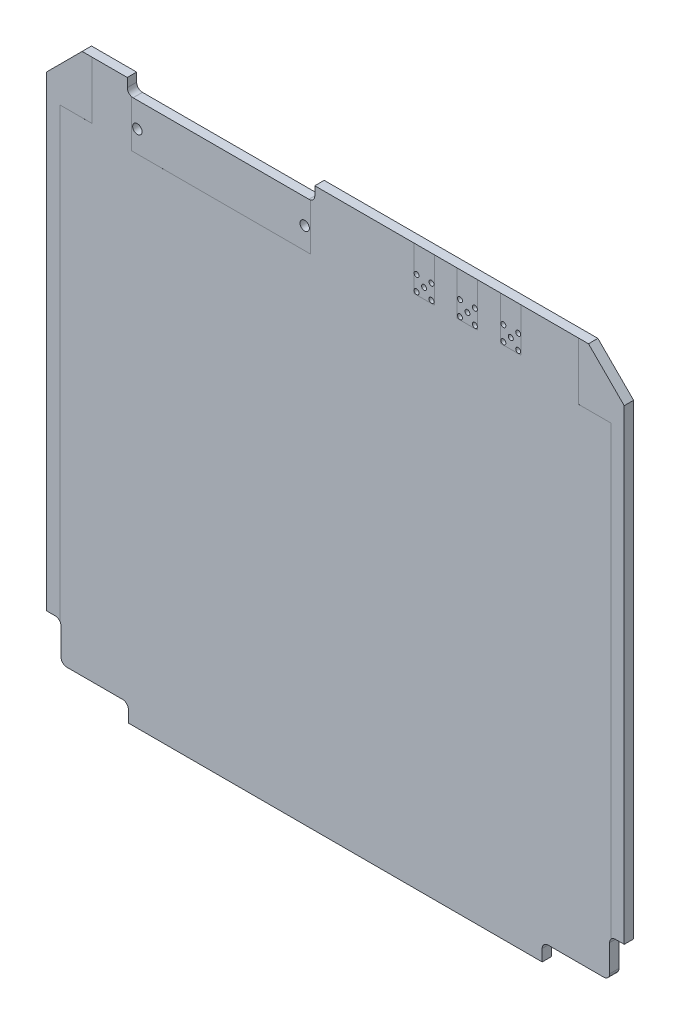
from build123d import *

# Parameters (mm, degrees)
SKETCH1_R           = 0.425
SKETCH1_R_2         = 0.8
BOSS_EXTRUDE1_DEPTH = 1.6
CUT_EXTRUDE1_DEPTH  = 0.0001
CUT_EXTRUDE2_DEPTH  = 0.0001
PARTFOOTPRINTS_W    = 30.48
PARTFOOTPRINTS_H    = 7.989227112
PARTFOOTPRINTS_W_2  = 3.5
PARTFOOTPRINTS_H_2  = 7.45
CUT_EXTRUDE3_DEPTH  = 0.0001


with BuildPart() as part:
    # Sketch1 → Boss-Extrude1 (new body)
    with BuildSketch(Plane(origin=(0, 0, -0.0125), x_dir=(-1, 0, 0), z_dir=(0, 0, -1))):
        with BuildLine():
            Line((35.3, -50), (35.3, -48))
            ThreePointArc((35.3, -48), (35.592893219, -47.292893219), (36.3, -47))
            Line((36.3, -47), (45.8, -47))
            ThreePointArc((45.8, -47), (46.507106781, -46.707106781), (46.8, -46))
            Line((46.8, -46), (46.8, -41.4))
            ThreePointArc((46.8, -41.4), (47.092893219, -40.692893219), (47.8, -40.4))
            Line((47.8, -40.4), (49.3, -40.4))
            Line((49.3, -40.4), (49.3, 39.2))
            Line((49.3, 39.2), (43.2, 45.3))
            Line((43.2, 45.3), (35.500000002, 45.3))
            Line((35.500000002, 45.3), (35.500000002, 43.8))
            ThreePointArc((35.500000002, 43.8), (35.207106783, 43.092893219), (34.500000002, 42.8))
            Line((34.500000002, 42.8), (4.499999998, 42.8))
            ThreePointArc((4.499999998, 42.8), (3.792893217, 43.092893219), (3.499999998, 43.8))
            Line((3.499999998, 43.8), (3.499999998, 45.3))
            Line((3.499999998, 45.3), (-43.2, 45.3))
            Line((-43.2, 45.3), (-49.3, 39.2))
            Line((-49.3, 39.2), (-49.3, -40.4))
            Line((-49.3, -40.4), (-47.8, -40.4))
            ThreePointArc((-47.8, -40.4), (-47.092893219, -40.692893219), (-46.8, -41.4))
            Line((-46.8, -41.4), (-46.8, -46))
            ThreePointArc((-46.8, -46), (-46.507106781, -46.707106781), (-45.8, -47))
            Line((-45.8, -47), (-36.3, -47))
            ThreePointArc((-36.3, -47), (-35.592893219, -47.292893219), (-35.3, -48))
            Line((-35.3, -48), (-35.3, -50))
            Line((-35.3, -50), (35.3, -50))
        make_face()
        with Locations(Location((-21.27, 40.87, 0), (0, 0, 180))):
            Circle(SKETCH1_R, mode=Mode.SUBTRACT)
        with Locations(Location((-23.81, 40.87, 0), (0, 0, 180))):
            Circle(SKETCH1_R, mode=Mode.SUBTRACT)
        with Locations(Location((-22.54, 39.6, 0), (0, 0, 180))):
            Circle(SKETCH1_R, mode=Mode.SUBTRACT)
        with Locations(Location((-13.87, 40.87, 0), (0, 0, 180))):
            Circle(SKETCH1_R, mode=Mode.SUBTRACT)
        with Locations(Location((-23.81, 38.33, 0), (0, 0, 180))):
            Circle(SKETCH1_R, mode=Mode.SUBTRACT)
        with Locations(Location((-16.41, 40.87, 0), (0, 0, 180))):
            Circle(SKETCH1_R, mode=Mode.SUBTRACT)
        with Locations(Location((-15.14, 39.6, 0), (0, 0, 180))):
            Circle(SKETCH1_R, mode=Mode.SUBTRACT)
        with Locations(Location((-21.27, 38.33, 0), (0, 0, 180))):
            Circle(SKETCH1_R, mode=Mode.SUBTRACT)
        with Locations(Location((-28.67, 40.87, 0), (0, 0, 180))):
            Circle(SKETCH1_R, mode=Mode.SUBTRACT)
        with Locations(Location((-31.21, 40.87, 0), (0, 0, 180))):
            Circle(SKETCH1_R, mode=Mode.SUBTRACT)
        with Locations(Location((-16.41, 38.33, 0), (0, 0, 180))):
            Circle(SKETCH1_R, mode=Mode.SUBTRACT)
        with Locations(Location((-29.94, 39.6, 0), (0, 0, 180))):
            Circle(SKETCH1_R, mode=Mode.SUBTRACT)
        with Locations(Location((-31.21, 38.33, 0), (0, 0, 180))):
            Circle(SKETCH1_R, mode=Mode.SUBTRACT)
        with Locations(Location((-28.67, 38.33, 0), (0, 0, 180))):
            Circle(SKETCH1_R, mode=Mode.SUBTRACT)
        with Locations(Location((33.775, 38.54, 0), (0, 0, 180))):
            Circle(SKETCH1_R_2, mode=Mode.SUBTRACT)
        with Locations((5.225, 38.54)):
            Circle(SKETCH1_R_2, mode=Mode.SUBTRACT)
        with Locations(Location((-13.87, 38.33, 0), (0, 0, 180))):
            Circle(SKETCH1_R, mode=Mode.SUBTRACT)
    extrude(amount=-BOSS_EXTRUDE1_DEPTH)

    # thermalContacts_lower → Cut-Extrude1 (cut)
    with BuildSketch(Plane(origin=(0, 0, -0.0125), x_dir=(-1, 0, 0), z_dir=(0, 0, -1))):
        Polygon((47, 35.5), (47, -41.5), (59.827263463, -41.5), (59.827263463, 47), (41.5, 47), (41.5, 41.5), (41.5, 35.5), align=None)
        Polygon((-47, 35.5), (-47, -41.5), (-56.192158269, -41.5), (-56.192158269, 47), (-41.5, 47), (-41.5, 41.5), (-41.5, 35.5), align=None)
    extrude(amount=-CUT_EXTRUDE1_DEPTH, mode=Mode.SUBTRACT)

    # thermalContacts_upper → Cut-Extrude2 (cut)
    with BuildSketch(Plane.XY.offset(1.5875)):
        Polygon((-47, 35.5), (-47, -41.5), (-56.192158269, -41.5), (-56.192158269, 47), (-41.5, 47), (-41.5, 41.5), (-41.5, 35.5), align=None)
        Polygon((47, 35.5), (47, -41.5), (59.827263463, -41.5), (59.827263463, 47), (41.5, 47), (41.5, 41.5), (41.5, 35.5), align=None)
    extrude(amount=-CUT_EXTRUDE2_DEPTH, mode=Mode.SUBTRACT)

    # partFootprints → Cut-Extrude3 (cut)
    with BuildSketch(Plane.XY.offset(1.5875)):
        with Locations((-19.5, 38.834613556)):
            Rectangle(PARTFOOTPRINTS_W, PARTFOOTPRINTS_H)
        with Locations((15.14, 41.575)):
            Rectangle(PARTFOOTPRINTS_W_2, PARTFOOTPRINTS_H_2)
        with Locations((22.54, 41.575)):
            Rectangle(PARTFOOTPRINTS_W_2, PARTFOOTPRINTS_H_2)
        with Locations((29.94, 41.575)):
            Rectangle(PARTFOOTPRINTS_W_2, PARTFOOTPRINTS_H_2)
    extrude(amount=-CUT_EXTRUDE3_DEPTH, mode=Mode.SUBTRACT)


solid = part.part
